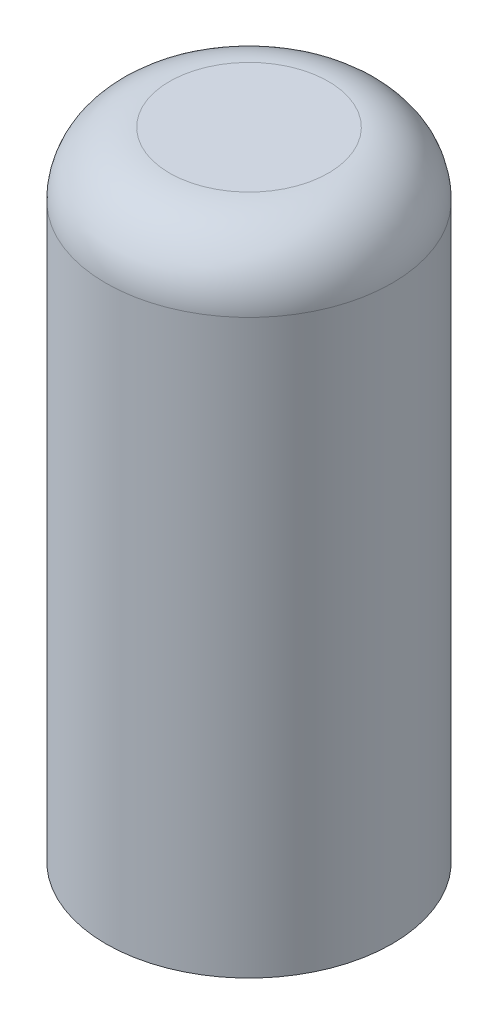
from build123d import *

# Parameters (mm, degrees)
SKIZZE1_R                       = 0.45
AUFSATZ_LINEAR_AUSTRAGEN1_DEPTH = 2
VERRUNDUNG1_R                   = 0.2


with BuildPart() as part:
    # Skizze1 → Aufsatz-Linear austragen1 (new body)
    with BuildSketch(Plane(origin=(0, 0, 0), x_dir=(1, 0, 0), z_dir=(0, 1, 0))):
        with Locations(Location((0, 0, 0), (0, 0, 270))):
            Circle(SKIZZE1_R)
    extrude(amount=AUFSATZ_LINEAR_AUSTRAGEN1_DEPTH)

    # Verrundung1
    verrundung1_edges = [part.edges().sort_by_distance(p)[0] for p in [
        (0, 2, -0.45),
    ]]
    fillet(verrundung1_edges, radius=VERRUNDUNG1_R)


solid = part.part
